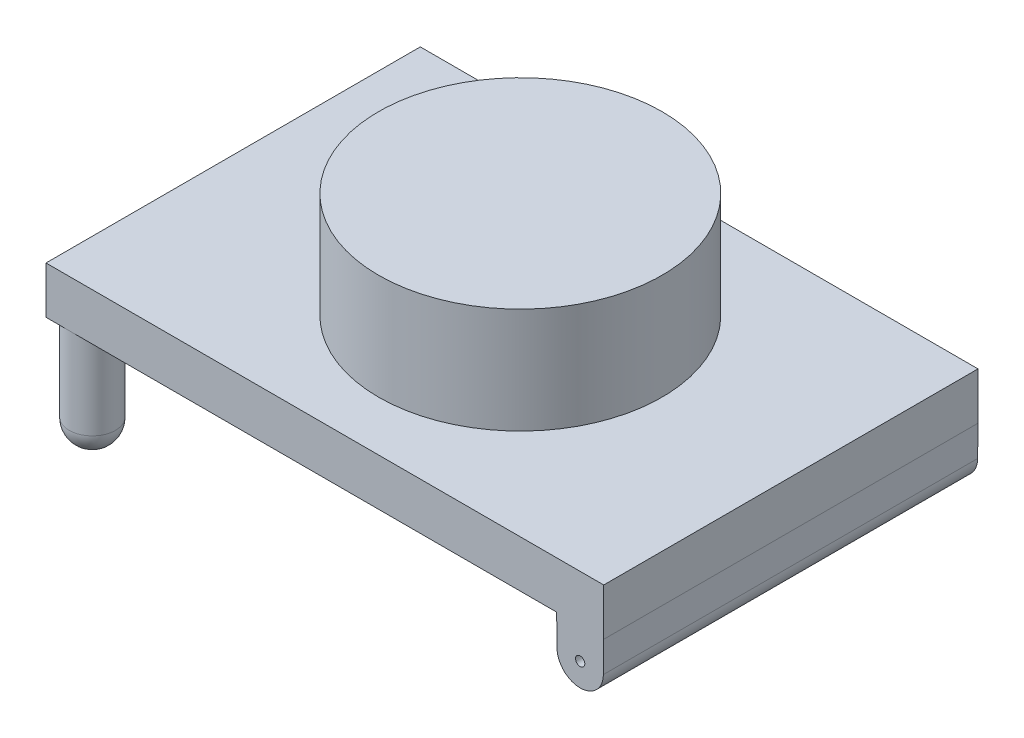
from build123d import *

# Parameters (mm, degrees)
SKETCH1_W           = 301
SKETCH1_H           = 202
BOSS_EXTRUDE1_DEPTH = 60
CUT_EXTRUDE1_DEPTH  = 259.948353924
SKETCH5_R           = 12.5
BOSS_EXTRUDE2_DEPTH = 59.1
FILLET1_R           = 12.5
SKETCH2_R           = 2.5
CUT_EXTRUDE2_DEPTH  = 259.948353924
SKETCH6_R           = 76.5
BOSS_EXTRUDE3_DEPTH = 57


with BuildPart() as part:
    # Sketch1 → Boss-Extrude1 (new body)
    with BuildSketch(Plane(origin=(0, 0, 0), x_dir=(1, 0, 0), z_dir=(0, 1, 0))):
        Rectangle(SKETCH1_W, SKETCH1_H)
    extrude(amount=BOSS_EXTRUDE1_DEPTH)

    # Sketch4 → Cut-Extrude1 (cut, through all)
    with BuildSketch(Plane.XY.offset(101)):
        with BuildLine():
            Line((125.3, 18), (125.1, 34.6))
            Line((125.1, 34.6), (-150.5, 34.6))
            Line((-150.5, 34.6), (-150.5, 0))
            Line((-150.5, 0), (150.5, 0))
            Line((150.5, 0), (150.5, 34.6))
            Line((150.5, 34.6), (150.3, 18))
            ThreePointArc((150.3, 18), (137.8, 5.5), (125.3, 18))
        make_face()
    extrude(amount=-CUT_EXTRUDE1_DEPTH, mode=Mode.SUBTRACT)

    # Sketch5 → Boss-Extrude2 (add)
    with BuildSketch(Plane.XZ.offset(-34.6)):
        with Locations(Location((-138, 88.5, 0), (0, 0, 90))):
            Circle(SKETCH5_R)
        with Locations(Location((-138, -88.5, 0), (0, 0, 270))):
            Circle(SKETCH5_R)
    extrude(amount=BOSS_EXTRUDE2_DEPTH)

    # Fillet1
    fillet1_edges = [part.edges().sort_by_distance(p)[0] for p in [
        (-138, -24.5, 76),
        (-138, -24.5, -76),
    ]]
    fillet(fillet1_edges, radius=FILLET1_R)

    # Sketch2 → Cut-Extrude2 (cut, through all)
    with BuildSketch(Plane.XY.offset(101)):
        with Locations((137.8, 18)):
            Circle(SKETCH2_R)
    extrude(amount=-CUT_EXTRUDE2_DEPTH, mode=Mode.SUBTRACT)

    # Sketch6 → Boss-Extrude3 (add)
    with BuildSketch(Plane(origin=(0, 60, 0), x_dir=(1, 0, 0), z_dir=(0, 1, 0))):
        with Locations(Location((2, 2.5, 0), (0, 0, 90))):
            Circle(SKETCH6_R)
    extrude(amount=BOSS_EXTRUDE3_DEPTH)


solid = part.part
